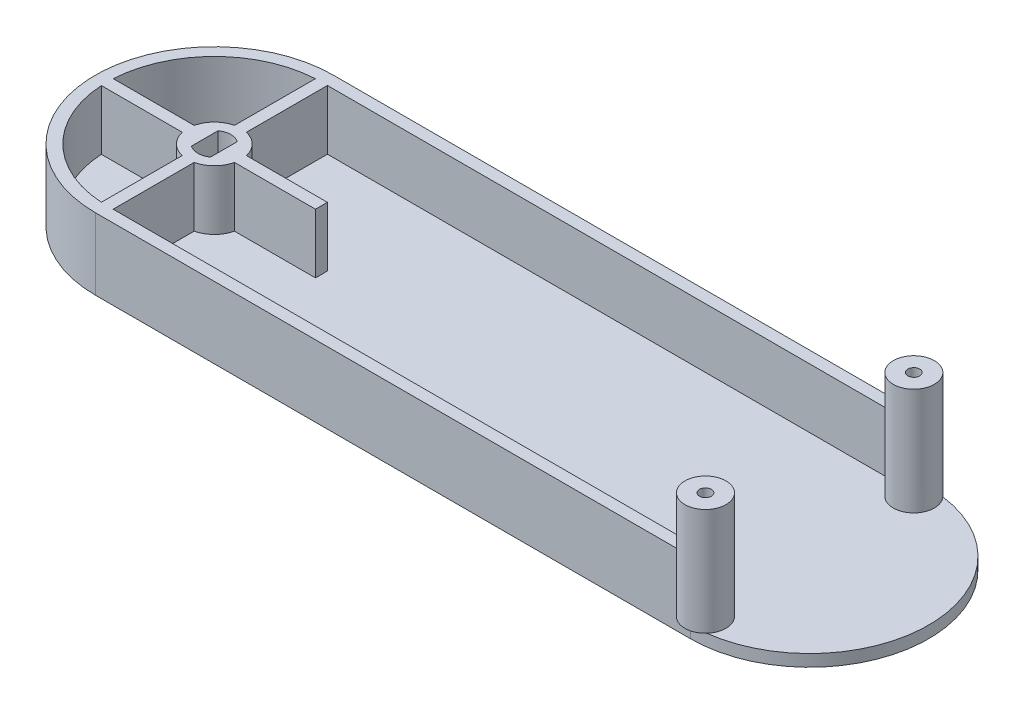
from build123d import *

# Parameters (mm, degrees)
BOSS_EXTRUDE1_DEPTH = 12
SHELL1_T            = -2
SKETCH3_R           = 2.75
CUT_EXTRUDE1_DEPTH  = 2
BOSS_EXTRUDE2_START = 10
SKETCH4_R           = 4.5
SKETCH4_R_2         = 2.75
BOSS_EXTRUDE2_DEPTH = 10
BOSS_EXTRUDE7_DEPTH = 10
SKETCH10_W          = 20
SKETCH10_H          = 40
CUT_EXTRUDE3_DEPTH  = 10
SKETCH9_R           = 3.45
SKETCH9_R_2         = 1
BOSS_EXTRUDE9_DEPTH = 18
CUT_EXTRUDE4_START  = -10
SKETCH11_R          = 1
CUT_EXTRUDE4_DEPTH  = 10


with BuildPart() as part:
    # Sketch1 → Boss-Extrude1 (new body)
    with BuildSketch(Plane(origin=(0, 0, 0), x_dir=(1, 0, 0), z_dir=(0, 1, 0))):
        with BuildLine():
            Line((-50, 20), (50, 20))
            ThreePointArc((50, 20), (70, 0), (50, -20))
            Line((50, -20), (-50, -20))
            ThreePointArc((-50, -20), (-70, 0), (-50, 20))
        make_face()
    extrude(amount=BOSS_EXTRUDE1_DEPTH)

    # Shell1
    shell1_openings = [part.faces().sort_by_distance(p)[0] for p in [
        (0, 12, 0),
    ]]
    offset(amount=SHELL1_T, openings=shell1_openings, kind=Kind.INTERSECTION)

    # Sketch3 → Cut-Extrude1 (cut)
    with BuildSketch(Plane(origin=(0, 2, 0), x_dir=(1, 0, 0), z_dir=(0, 1, 0))):
        with Locations(Location((-50, 0, 0), (0, 0, 270))):
            Circle(SKETCH3_R)
    extrude(amount=-CUT_EXTRUDE1_DEPTH, mode=Mode.SUBTRACT)

    # Sketch4 → Boss-Extrude2 (add)
    # profile 1 of 3: a face of its own
    with BuildSketch(Plane(origin=(0, 2, 0), x_dir=(1, 0, 0), z_dir=(0, 1, 0)).offset(BOSS_EXTRUDE2_START)):
        with Locations(Location((-50, 0, 0), (0, 0, 270))):
            Circle(SKETCH4_R)
        with Locations(Location((-50, 0, 0), (0, 0, 270))):
            Circle(SKETCH4_R_2, mode=Mode.SUBTRACT)
    # profile 2 of 3: a face of its own
    with BuildSketch(Plane(origin=(0, 2, 0), x_dir=(1, 0, 0), z_dir=(0, 1, 0)).offset(BOSS_EXTRUDE2_START)):
        with BuildLine():
            ThreePointArc((-47.25, 0), (-47.55434058, 1.257477634), (-48.4, 2.236626925))
            Line((-48.4, 2.236626925), (-48.4, -2.236626925))
            ThreePointArc((-48.4, -2.236626925), (-47.55434058, -1.257477634), (-47.25, 0))
        make_face()
    # profile 3 of 3: a face of its own
    with BuildSketch(Plane(origin=(0, 2, 0), x_dir=(1, 0, 0), z_dir=(0, 1, 0)).offset(BOSS_EXTRUDE2_START)):
        with BuildLine():
            Line((-51.6, -2.236626925), (-51.6, 2.236626925))
            ThreePointArc((-51.6, 2.236626925), (-52.75, 0), (-51.6, -2.236626925))
        make_face()
    extrude(amount=-BOSS_EXTRUDE2_DEPTH)

    # Sketch7 → Boss-Extrude7 (add)
    with BuildSketch(Plane(origin=(0, 2, 0), x_dir=(1, 0, 0), z_dir=(0, 1, 0))):
        with BuildLine():
            Line((-51, 17.972200756), (-51, 4.387482194))
            ThreePointArc((-51, 4.387482194), (-50, 4.5), (-49, 4.387482194))
            Line((-49, 4.387482194), (-49, 17.972200756))
            ThreePointArc((-49, 17.972200756), (-49.499806838, 17.993048847), (-50, 18))
            ThreePointArc((-50, 18), (-50.500193162, 17.993048847), (-51, 17.972200756))
        make_face()
        with BuildLine():
            Line((-51, 18), (-51, 17.972200756))
            ThreePointArc((-51, 17.972200756), (-50.500193162, 17.993048847), (-50, 18))
            Line((-50, 18), (-51, 18))
        make_face()
        with BuildLine():
            ThreePointArc((-50, 18), (-49.499806838, 17.993048847), (-49, 17.972200756))
            Line((-49, 17.972200756), (-49, 18))
            Line((-49, 18), (-50, 18))
        make_face()
        with BuildLine():
            Line((-32.027799244, 1), (-45.612517806, 1))
            ThreePointArc((-45.612517806, 1), (-45.528217924, 0.503155109), (-45.5, 0))
            ThreePointArc((-45.5, 0), (-45.528217924, -0.503155109), (-45.612517806, -1))
            Line((-45.612517806, -1), (-32.027799244, -1))
            ThreePointArc((-32.027799244, -1), (-32.006951153, -0.500193162), (-32, 0))
            ThreePointArc((-32, 0), (-32.006951153, 0.500193162), (-32.027799244, 1))
        make_face()
        with BuildLine():
            ThreePointArc((-49, -4.387482194), (-50, -4.5), (-51, -4.387482194))
            Line((-51, -4.387482194), (-51, -17.972200756))
            ThreePointArc((-51, -17.972200756), (-50.500193162, -17.993048847), (-50, -18))
            ThreePointArc((-50, -18), (-49.499806838, -17.993048847), (-49, -17.972200756))
            Line((-49, -17.972200756), (-49, -4.387482194))
        make_face()
        with BuildLine():
            Line((-49, -18), (-49, -17.972200756))
            ThreePointArc((-49, -17.972200756), (-49.499806838, -17.993048847), (-50, -18))
            Line((-50, -18), (-49, -18))
        make_face()
        with BuildLine():
            ThreePointArc((-54.387482194, -1), (-54.5, 0), (-54.387482194, 1))
            Line((-54.387482194, 1), (-67.972200756, 1))
            ThreePointArc((-67.972200756, 1), (-67.993048847, 0.500193146), (-68, -3.2e-08))
            ThreePointArc((-68, -3.2e-08), (-67.993048846, -0.500193178), (-67.972200756, -1))
            Line((-67.972200756, -1), (-54.387482194, -1))
        make_face()
    extrude(amount=BOSS_EXTRUDE7_DEPTH)

    # Sketch10 → Cut-Extrude3 (cut)
    with BuildSketch(Plane(origin=(0, 12, 0), x_dir=(1, 0, 0), z_dir=(0, 1, 0))):
        with Locations((60, 0)):
            Rectangle(SKETCH10_W, SKETCH10_H)
    extrude(amount=-CUT_EXTRUDE3_DEPTH, mode=Mode.SUBTRACT)

    # Sketch9 → Boss-Extrude9 (add)
    # profile 1 of 2: a face of its own
    with BuildSketch(Plane(origin=(0, 2, 0), x_dir=(1, 0, 0), z_dir=(0, 1, 0))):
        with Locations(Location((50, -17.5, 0), (0, 0, 188.333082996))):
            Circle(SKETCH9_R)
        with Locations(Location((50, -17.5, 0), (0, 0, 270))):
            Circle(SKETCH9_R_2, mode=Mode.SUBTRACT)
    # profile 2 of 2: a face of its own
    with BuildSketch(Plane(origin=(0, 2, 0), x_dir=(1, 0, 0), z_dir=(0, 1, 0))):
        with Locations(Location((50, 17.5, 0), (0, 0, 90))):
            Circle(SKETCH9_R)
        with Locations(Location((50, 17.5, 0), (0, 0, 90))):
            Circle(SKETCH9_R_2, mode=Mode.SUBTRACT)
    extrude(amount=BOSS_EXTRUDE9_DEPTH)

    # Sketch11 → Cut-Extrude4 (cut)
    with BuildSketch(Plane(origin=(0, 12, 0), x_dir=(1, 0, 0), z_dir=(0, 1, 0)).offset(CUT_EXTRUDE4_START)):
        with Locations(Location((50, 17.5, 0), (0, 0, 90))):
            Circle(SKETCH11_R)
        with Locations(Location((50, -17.5, 0), (0, 0, 270))):
            Circle(SKETCH11_R)
    extrude(amount=CUT_EXTRUDE4_DEPTH, mode=Mode.SUBTRACT)


solid = part.part
